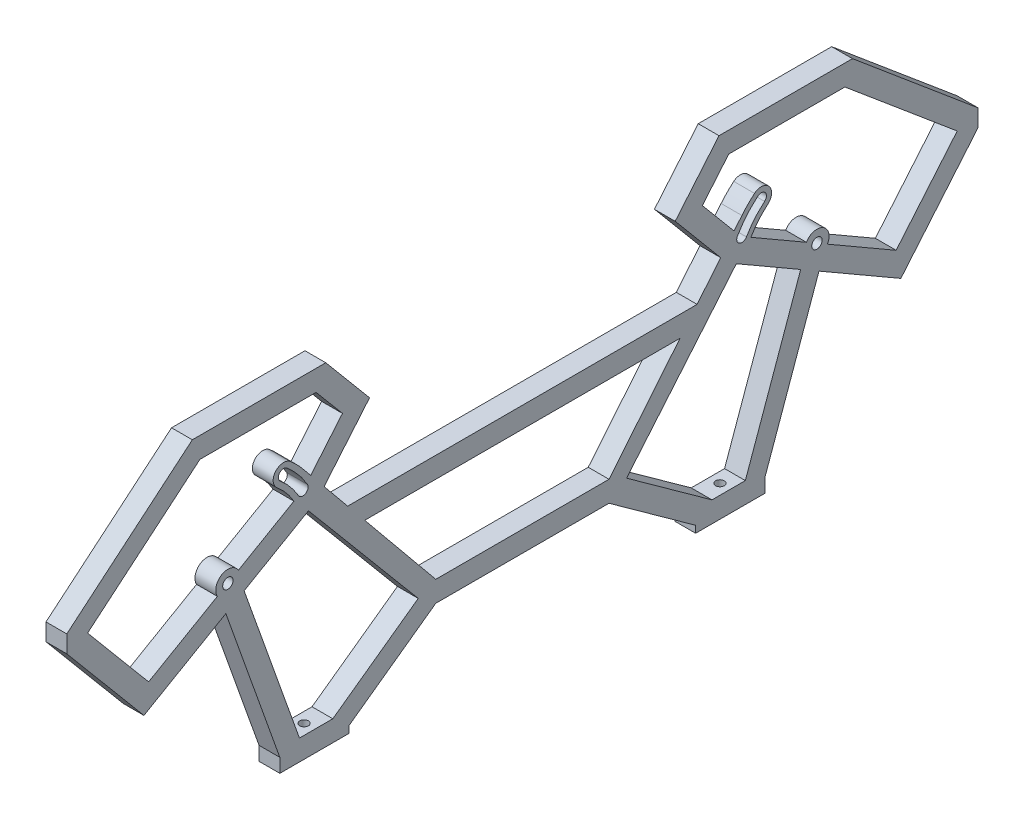
from build123d import *

# Parameters (mm, degrees)
SKETCH1_R           = 1.5
BOSS_EXTRUDE1_DEPTH = 6


with BuildPart() as part:
    # Sketch1 → Boss-Extrude1 (new body)
    with BuildSketch(Plane(origin=(0, 0, 0), x_dir=(0, 0, -1), z_dir=(1, 0, 0))):
        Polygon((50, 0), (70, 0), (70, 4), (85.592625509, 47.729644272), (109.224105862, 34.086002729), (131.486359031, 60.617122922), (131.486359031, 65.598790277), (95.255608124, 96), (56.74353499, 96), (44.099407436, 80.931315562), (57.225143451, 65.28867251), (50.426653107, 57), (0, 57), (0, 51), (45.505365409, 51), (25, 26), (0, 26), (0, 20), (25, 20), (50, 2), align=None)
        with Locations((85, 55)):
            Circle(SKETCH1_R, mode=Mode.SUBTRACT)
        Polygon((30.059592338, 23.750495981), (61.737302817, 61.50252125), (80.310098668, 50.779512566), (64.343122912, 6), (54.713058978, 6), align=None, mode=Mode.SUBTRACT)
        with BuildLine():
            Line((59.541380939, 90), (51.931851172, 80.931315562))
            Line((51.931851172, 80.931315562), (61.09679395, 70.00896208))
            Line((61.09679395, 70.00896208), (63.350780176, 72.757006533))
            ThreePointArc((63.350780176, 72.757006533), (65.090587223, 74.687947655), (67.001946929, 76.449244407))
            ThreePointArc((67.001946929, 76.449244407), (71.228443087, 76.079473907), (70.858672587, 71.852977749))
            ThreePointArc((70.858672587, 71.852977749), (68.147022251, 69.141327413), (65.947441117, 66))
            Line((65.947441117, 66), (81.968911087, 56.75))
            ThreePointArc((81.968911087, 56.75), (86.75, 58.031088913), (88.031088913, 53.25))
            Line((88.031088913, 53.25), (107.864016281, 41.799454045))
            Line((107.864016281, 41.799454045), (125.486359031, 62.800944328))
            Line((125.486359031, 62.800944328), (93.071786719, 90))
            Line((93.071786719, 90), (59.541380939, 90))
        make_face(mode=Mode.SUBTRACT)
        with BuildLine():
            ThreePointArc((67.966128343, 75.300177743), (64.699822257, 72.033871657), (62.0503268, 68.25))
            ThreePointArc((62.0503268, 68.25), (62.599364905, 66.200961894), (64.648403011, 66.75))
            ThreePointArc((64.648403011, 66.75), (66.997955587, 70.105508828), (69.894491172, 73.002044413))
            ThreePointArc((69.894491172, 73.002044413), (70.079376423, 75.115292493), (67.966128343, 75.300177743))
        make_face(mode=Mode.SUBTRACT)
    boss_extrude1 = extrude(amount=BOSS_EXTRUDE1_DEPTH)

    # Sketch2 → Tap Drill for M3 Tap1 (revolve, cut)
    with BuildSketch(Plane(origin=(3, 0, -60), x_dir=(0, 0, -1), z_dir=(1, 0, 0))):
        Polygon((0, 0), (0, 10.751075774), (1.25, 10), (1.25, 0), align=None)
    tap_drill_for_m3_tap1 = revolve(axis=Axis((3, -6.35, -60), (0, 1, 0)), mode=Mode.SUBTRACT)

    # Mirror1: Boss-Extrude1, Tap Drill for M3 Tap1 across plane
    add(boss_extrude1.mirror(Plane.XY))
    add(tap_drill_for_m3_tap1.mirror(Plane.XY), mode=Mode.SUBTRACT)


solid = part.part
